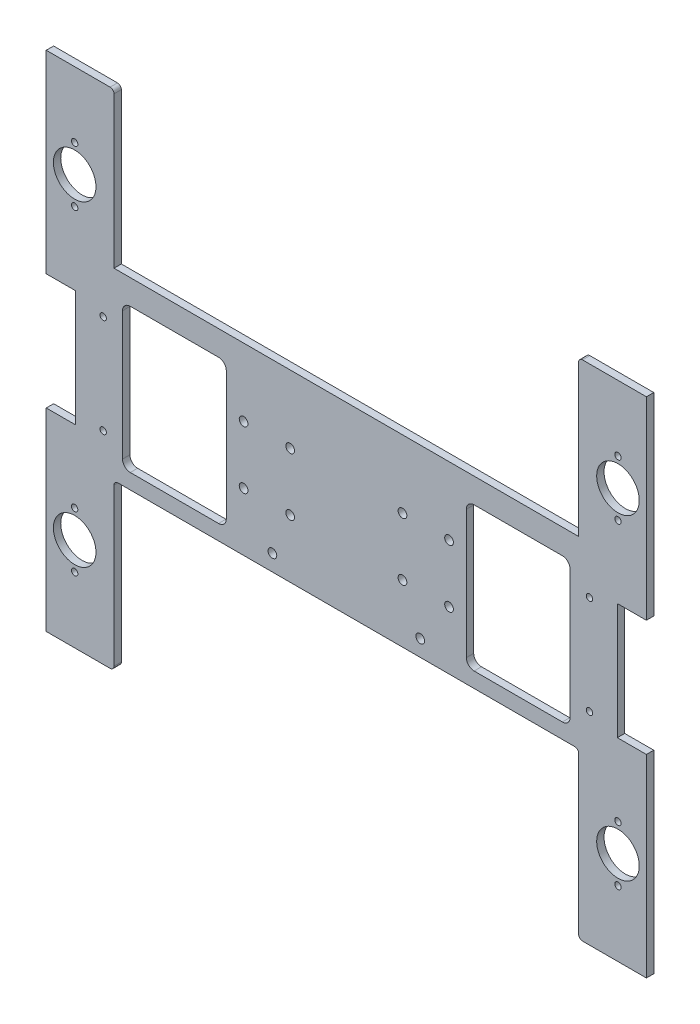
from build123d import *

# Parameters (mm, degrees)
SKETCH2_R           = 1.65
SKETCH2_R_2         = 11
SKETCH2_R_3         = 2.25
BOSS_EXTRUDE1_DEPTH = 3.8


with BuildPart() as part:
    # Sketch2 → Boss-Extrude1 (new body)
    with BuildSketch(Plane.XY):
        with BuildLine():
            Line((-155, 155), (-122, 155))
            ThreePointArc((-122, 155), (-120.585786438, 154.414213562), (-120, 153))
            Line((-120, 153), (-120, 75))
            Line((-120, 75), (120, 75))
            Line((120, 75), (120, 153))
            ThreePointArc((120, 153), (120.585786438, 154.414213562), (122, 155))
            Line((122, 155), (155, 155))
            Line((155, 155), (155, 55))
            Line((155, 55), (140, 55))
            Line((140, 55), (140, -5))
            Line((140, -5), (155, -5))
            Line((155, -5), (155, -105))
            Line((155, -105), (122, -105))
            ThreePointArc((122, -105), (120.585786438, -104.414213562), (120, -103))
            Line((120, -103), (120, -22))
            ThreePointArc((120, -22), (119.414213562, -20.585786438), (118, -20))
            Line((118, -20), (-118, -20))
            ThreePointArc((-118, -20), (-119.414213562, -20.585786438), (-120, -22))
            Line((-120, -22), (-120, -103))
            ThreePointArc((-120, -103), (-120.585786438, -104.414213562), (-122, -105))
            Line((-122, -105), (-155, -105))
            Line((-155, -105), (-155, -5))
            Line((-155, -5), (-140, -5))
            Line((-140, -5), (-140, 55))
            Line((-140, 55), (-155, 55))
            Line((-155, 55), (-155, 155))
        make_face()
        with Locations(Location((-140.309773495, 121.076789794, 0), (0, 0, 180))):
            Circle(SKETCH2_R, mode=Mode.SUBTRACT)
        with Locations(Location((-140.309773495, 92.407184142, 0), (0, 0, 180))):
            Circle(SKETCH2_R, mode=Mode.SUBTRACT)
        with Locations(Location((140.309773495, 121.076789794, 0), (0, 0, 180))):
            Circle(SKETCH2_R, mode=Mode.SUBTRACT)
        with Locations(Location((140.309773495, 92.407184142, 0), (0, 0, 180))):
            Circle(SKETCH2_R, mode=Mode.SUBTRACT)
        with Locations(Location((140.309773495, 106.741986968, 0), (0, 0, 180))):
            Circle(SKETCH2_R_2, mode=Mode.SUBTRACT)
        with Locations(Location((-140.309773495, 106.741986968, 0), (0, 0, 180))):
            Circle(SKETCH2_R_2, mode=Mode.SUBTRACT)
        with Locations(Location((125.59774802, -0.5, 0), (0, 0, 180))):
            Circle(SKETCH2_R, mode=Mode.SUBTRACT)
        with Locations(Location((125.59774802, 50.5, 0), (0, 0, 180))):
            Circle(SKETCH2_R, mode=Mode.SUBTRACT)
        with Locations(Location((-125.59774802, -0.5, 0), (0, 0, 180))):
            Circle(SKETCH2_R, mode=Mode.SUBTRACT)
        with Locations(Location((-125.59774802, 50.5, 0), (0, 0, 180))):
            Circle(SKETCH2_R, mode=Mode.SUBTRACT)
        with Locations(Location((-29, 10.055, 0), (0, 0, 180))):
            Circle(SKETCH2_R_3, mode=Mode.SUBTRACT)
        with Locations(Location((-29, 39.945, 0), (0, 0, 180))):
            Circle(SKETCH2_R_3, mode=Mode.SUBTRACT)
        with Locations(Location((-53.06, 39.945, 0), (0, 0, 180))):
            Circle(SKETCH2_R_3, mode=Mode.SUBTRACT)
        with Locations(Location((-53.06, 10.055, 0), (0, 0, 180))):
            Circle(SKETCH2_R_3, mode=Mode.SUBTRACT)
        with Locations(Location((53.06, 10.055, 0), (0, 0, 180))):
            Circle(SKETCH2_R_3, mode=Mode.SUBTRACT)
        with Locations(Location((29, 10.055, 0), (0, 0, 180))):
            Circle(SKETCH2_R_3, mode=Mode.SUBTRACT)
        with Locations(Location((29, 39.945, 0), (0, 0, 180))):
            Circle(SKETCH2_R_3, mode=Mode.SUBTRACT)
        with Locations(Location((53.06, 39.945, 0), (0, 0, 180))):
            Circle(SKETCH2_R_3, mode=Mode.SUBTRACT)
        with Locations(Location((140.309773495, -71.076789794, 0), (0, 0, 180))):
            Circle(SKETCH2_R, mode=Mode.SUBTRACT)
        with Locations(Location((140.309773495, -42.407184142, 0), (0, 0, 180))):
            Circle(SKETCH2_R, mode=Mode.SUBTRACT)
        with Locations(Location((140.309773495, -56.741986968, 0), (0, 0, 180))):
            Circle(SKETCH2_R_2, mode=Mode.SUBTRACT)
        with Locations(Location((-140.309773495, -56.741986968, 0), (0, 0, 180))):
            Circle(SKETCH2_R_2, mode=Mode.SUBTRACT)
        with Locations(Location((-140.309773495, -42.407184142, 0), (0, 0, 180))):
            Circle(SKETCH2_R, mode=Mode.SUBTRACT)
        with Locations(Location((-140.309773495, -71.076789794, 0), (0, 0, 180))):
            Circle(SKETCH2_R, mode=Mode.SUBTRACT)
        with Locations(Location((38.179918963, -11.563765186, 0), (0, 0, 180))):
            Circle(SKETCH2_R_3, mode=Mode.SUBTRACT)
        with Locations(Location((-38.179918963, -11.563765186, 0), (0, 0, 180))):
            Circle(SKETCH2_R_3, mode=Mode.SUBTRACT)
        with BuildLine():
            Line((-66, 62.171403079), (-111.59774802, 62.171403079))
            ThreePointArc((-111.59774802, 62.171403079), (-114.426175145, 60.999830204), (-115.59774802, 58.171403079))
            Line((-115.59774802, 58.171403079), (-115.59774802, -8.171403079))
            ThreePointArc((-115.59774802, -8.171403079), (-114.426175145, -10.999830204), (-111.59774802, -12.171403079))
            Line((-111.59774802, -12.171403079), (-66, -12.171403079))
            ThreePointArc((-66, -12.171403079), (-63.171572875, -10.999830204), (-62, -8.171403079))
            Line((-62, -8.171403079), (-62, 58.171403079))
            ThreePointArc((-62, 58.171403079), (-63.171572875, 60.999830204), (-66, 62.171403079))
        make_face(mode=Mode.SUBTRACT)
        with BuildLine():
            Line((66, 62.171403079), (111.59774802, 62.171403079))
            ThreePointArc((111.59774802, 62.171403079), (114.426175145, 60.999830204), (115.59774802, 58.171403079))
            Line((115.59774802, 58.171403079), (115.59774802, -8.171403079))
            ThreePointArc((115.59774802, -8.171403079), (114.426175145, -10.999830204), (111.59774802, -12.171403079))
            Line((111.59774802, -12.171403079), (66, -12.171403079))
            ThreePointArc((66, -12.171403079), (63.171572875, -10.999830204), (62, -8.171403079))
            Line((62, -8.171403079), (62, 58.171403079))
            ThreePointArc((62, 58.171403079), (63.171572875, 60.999830204), (66, 62.171403079))
        make_face(mode=Mode.SUBTRACT)
    extrude(amount=BOSS_EXTRUDE1_DEPTH)


solid = part.part
